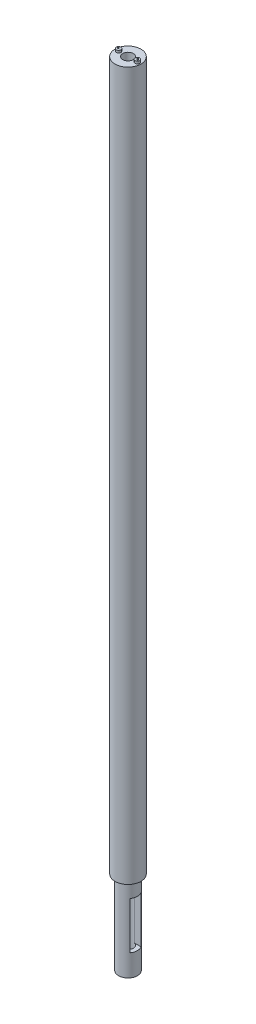
from build123d import *

# Parameters (mm, degrees)
SWEEP3_PROFILE_R    = 4
SWEEP4_PROFILE_R    = 5.5
SKETCH45_R          = 2.25
CUT_EXTRUDE2_DEPTH  = 337.377466094
SWEEP5_PROFILE_R    = 0.25
SWEEP6_PROFILE_R    = 0.25
SKETCH72_W          = 4.5
SKETCH72_H          = 20
CUT_EXTRUDE6_DEPTH  = 20
SKETCH77_R          = 1
BOSS_EXTRUDE1_DEPTH = 1


with BuildPart() as part:
    # Sweep3: sweep along a path in Sketch31
    with BuildLine(Plane.XY) as sweep3_path:
        Line((0, 0), (0, 35.470165431))
    # Sweep3 profile (on start of the path) → Sweep3 (sweep)
    with BuildSketch(Plane.ZX):
        Circle(SWEEP3_PROFILE_R)
    sweep(path=sweep3_path.line)

    # Sweep4: sweep along a path in Sketch38
    with BuildLine(Plane.XY) as sweep4_path:
        Line((0, 35.470165431), (0, 336.287525335))
    # Sweep4 profile (on start of the path) → Sweep4 (sweep)
    with BuildSketch(Plane.ZX.offset(35.470165431)):
        Circle(SWEEP4_PROFILE_R)
    sweep(path=sweep4_path.line)

    # Sketch45 → Cut-Extrude2 (cut, through all)
    with BuildSketch(Plane(origin=(0, 0, 0), x_dir=(1, 0, 0), z_dir=(0, 1, 0))):
        with Locations(Location((0, 0, 0), (0, 0, 270))):
            Circle(SKETCH45_R)
    extrude(amount=CUT_EXTRUDE2_DEPTH, mode=Mode.SUBTRACT)

    # Sweep5: sweep along a curve in space
    with BuildLine() as sweep5_path:
        Line((4.125, 336.287525335, 5.531e-06), (4.125, 337.787525335, 5.531e-06))
    # Sweep5 profile (on start of the path) → Sweep5 (sweep)
    with BuildSketch(Plane(origin=(4.125, 336.287525335, 5.531e-06), x_dir=(0, 0, 1), z_dir=(0, 1, 0))):
        Circle(SWEEP5_PROFILE_R)
    sweep(path=sweep5_path.line)

    # Sweep6: sweep along a curve in space
    with BuildLine() as sweep6_path:
        Line((-4.125, 336.287525335, 9.31e-07), (-4.125, 337.787525335, 9.31e-07))
    # Sweep6 profile (on start of the path) → Sweep6 (sweep)
    with BuildSketch(Plane(origin=(-4.125, 336.287525335, 9.31e-07), x_dir=(0, 0, 1), z_dir=(0, 1, 0))):
        Circle(SWEEP6_PROFILE_R)
    sweep(path=sweep6_path.line)

    # Sketch72 → Cut-Extrude6 (cut)
    with BuildSketch(Plane(origin=(0, 0, 0), x_dir=(0, 0, -1), z_dir=(1, 0, 0))):
        with Locations((-0.068000409, 19.236124066)):
            Rectangle(SKETCH72_W, SKETCH72_H)
    extrude(amount=CUT_EXTRUDE6_DEPTH, mode=Mode.SUBTRACT)

    # Sketch77 → Boss-Extrude1 (add)
    with BuildSketch(Plane(origin=(0, 336.287525335, 0), x_dir=(1, 0, 0), z_dir=(0, 1, 0))):
        with Locations(Location((-4, -9.03e-07, 0), (0, 0, 270))):
            Circle(SKETCH77_R)
        with Locations(Location((4, -5.363e-06, 0), (0, 0, 270))):
            Circle(SKETCH77_R)
    extrude(amount=BOSS_EXTRUDE1_DEPTH)


solid = part.part
